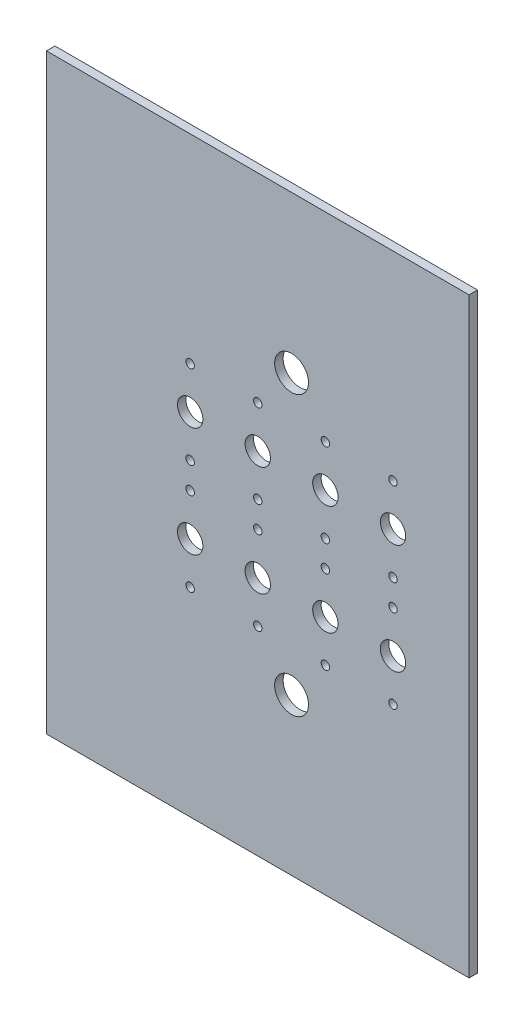
from build123d import *

# Parameters (mm, degrees)
SKETCH_1_W      = 500
SKETCH_1_H      = 700
SKETCH_1_R      = 5
SKETCH_1_R_2    = 20
SKETCH_1_R_3    = 15
EXTRUDE_1_DEPTH = 10


with BuildPart() as part:
    # 草图1 → 凸台-拉伸1 (new body)
    with BuildSketch(Plane.XY):
        with Locations((250, 0)):
            Rectangle(SKETCH_1_W, SKETCH_1_H)
        with Locations((170, 114.5)):
            Circle(SKETCH_1_R, mode=Mode.SUBTRACT)
        with Locations((170, 15.5)):
            Circle(SKETCH_1_R, mode=Mode.SUBTRACT)
        with Locations((250, 114.5)):
            Circle(SKETCH_1_R, mode=Mode.SUBTRACT)
        with Locations((250, 15.5)):
            Circle(SKETCH_1_R, mode=Mode.SUBTRACT)
        with Locations((330, 114.5)):
            Circle(SKETCH_1_R, mode=Mode.SUBTRACT)
        with Locations((330, 15.5)):
            Circle(SKETCH_1_R, mode=Mode.SUBTRACT)
        with Locations((410, 114.5)):
            Circle(SKETCH_1_R, mode=Mode.SUBTRACT)
        with Locations((410, 15.5)):
            Circle(SKETCH_1_R, mode=Mode.SUBTRACT)
        with Locations((290, 165)):
            Circle(SKETCH_1_R_2, mode=Mode.SUBTRACT)
        with Locations((290, -165)):
            Circle(SKETCH_1_R_2, mode=Mode.SUBTRACT)
        with Locations((170, 65)):
            Circle(SKETCH_1_R_3, mode=Mode.SUBTRACT)
        with Locations((250, 65)):
            Circle(SKETCH_1_R_3, mode=Mode.SUBTRACT)
        with Locations((330, 65)):
            Circle(SKETCH_1_R_3, mode=Mode.SUBTRACT)
        with Locations((410, 65)):
            Circle(SKETCH_1_R_3, mode=Mode.SUBTRACT)
        with Locations((170, -114.5)):
            Circle(SKETCH_1_R, mode=Mode.SUBTRACT)
        with Locations((170, -15.5)):
            Circle(SKETCH_1_R, mode=Mode.SUBTRACT)
        with Locations((250, -114.5)):
            Circle(SKETCH_1_R, mode=Mode.SUBTRACT)
        with Locations((250, -15.5)):
            Circle(SKETCH_1_R, mode=Mode.SUBTRACT)
        with Locations((330, -114.5)):
            Circle(SKETCH_1_R, mode=Mode.SUBTRACT)
        with Locations((330, -15.5)):
            Circle(SKETCH_1_R, mode=Mode.SUBTRACT)
        with Locations((410, -114.5)):
            Circle(SKETCH_1_R, mode=Mode.SUBTRACT)
        with Locations((410, -15.5)):
            Circle(SKETCH_1_R, mode=Mode.SUBTRACT)
        with Locations((170, -65)):
            Circle(SKETCH_1_R_3, mode=Mode.SUBTRACT)
        with Locations((250, -65)):
            Circle(SKETCH_1_R_3, mode=Mode.SUBTRACT)
        with Locations((330, -65)):
            Circle(SKETCH_1_R_3, mode=Mode.SUBTRACT)
        with Locations((410, -65)):
            Circle(SKETCH_1_R_3, mode=Mode.SUBTRACT)
    extrude(amount=EXTRUDE_1_DEPTH)


solid = part.part
